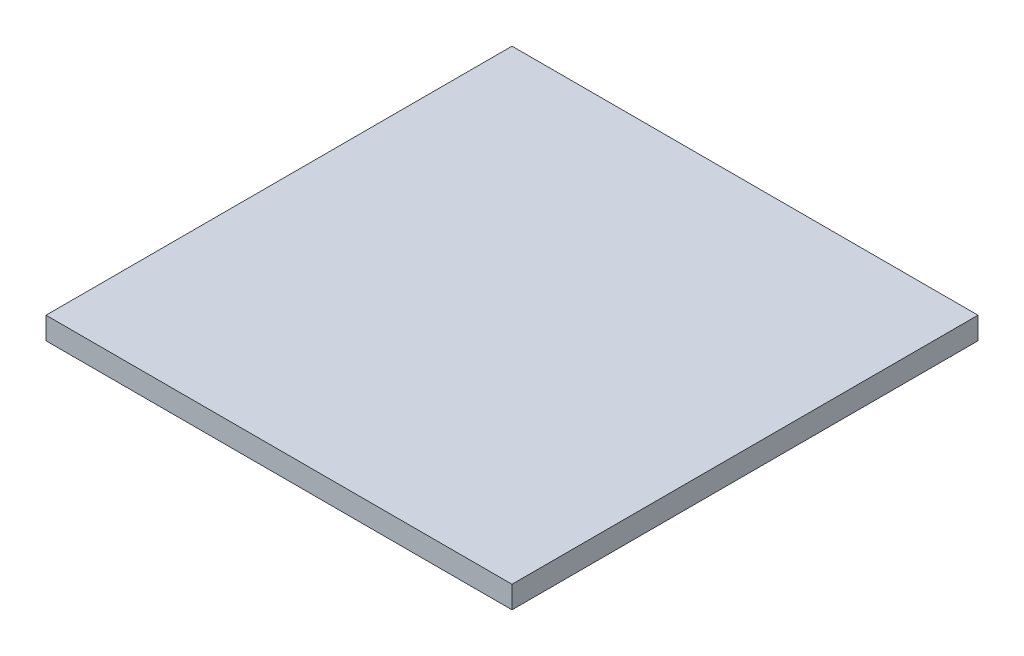
from build123d import *

# Parameters (mm, degrees)
SKETCH1_W           = 42
SKETCH1_H           = 42
BOSS_EXTRUDE1_DEPTH = 2


with BuildPart() as part:
    # Sketch1 → Boss-Extrude1 (new body)
    with BuildSketch(Plane(origin=(0, 0, 0), x_dir=(1, 0, 0), z_dir=(0, 1, 0))):
        with Locations((21, -21)):
            Rectangle(SKETCH1_W, SKETCH1_H)
    extrude(amount=BOSS_EXTRUDE1_DEPTH)


solid = part.part
